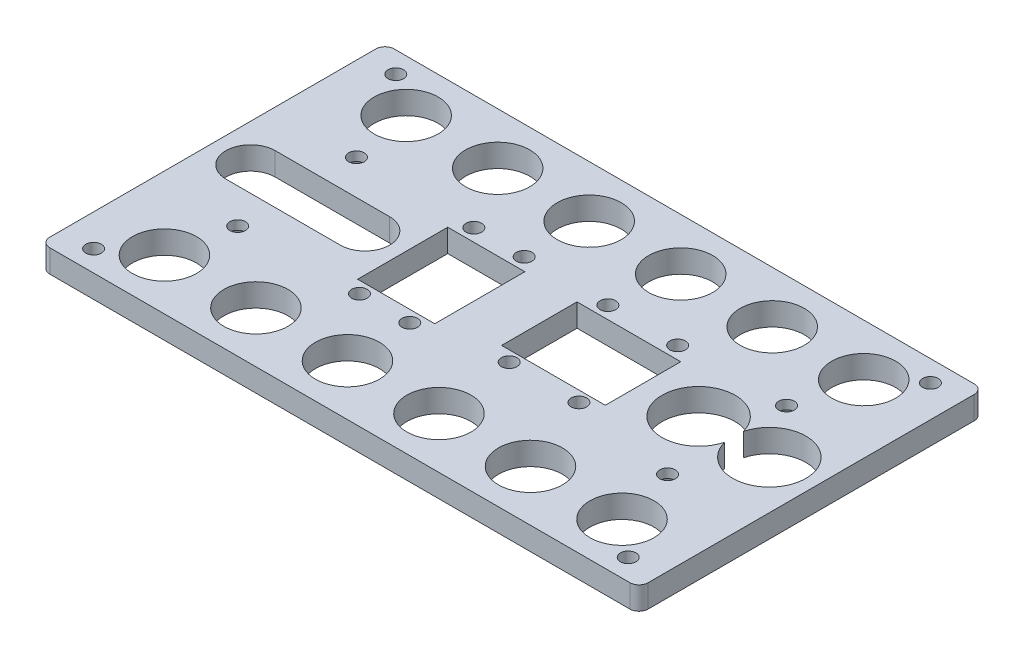
from build123d import *

# Parameters (mm, degrees)
SKETCH1_W           = 130.782832276
SKETCH1_H           = 75.259371088
SKETCH1_R           = 1.7
SKETCH1_R_2         = 7
SKETCH1_W_2         = 16.85151746
SKETCH1_H_2         = 19.689667769
SKETCH1_W_3         = 22.664698662
SKETCH1_H_3         = 16.485400984
BOSS_EXTRUDE3_DEPTH = 5
CUT_EXTRUDE1_DEPTH  = 3
FILLET1_R           = 2


with BuildPart() as part:
    # Sketch1 → Boss-Extrude3 (new body)
    with BuildSketch(Plane(origin=(0, 0, 0), x_dir=(1, 0, 0), z_dir=(0, 1, 0))):
        Rectangle(SKETCH1_W, SKETCH1_H)
        with Locations(Location((-58.42, 33.02, 0), (0, 0, 270))):
            Circle(SKETCH1_R, mode=Mode.SUBTRACT)
        with Locations(Location((-58.42, -33.02, 0), (0, 0, 270))):
            Circle(SKETCH1_R, mode=Mode.SUBTRACT)
        with Locations(Location((58.42, 33.02, 0), (0, 0, 270))):
            Circle(SKETCH1_R, mode=Mode.SUBTRACT)
        with Locations(Location((58.42, -33.02, 0), (0, 0, 270))):
            Circle(SKETCH1_R, mode=Mode.SUBTRACT)
        with Locations(Location((-20.838777713, 12.499959088, 0), (0, 0, 270))):
            Circle(SKETCH1_R, mode=Mode.SUBTRACT)
        with Locations(Location((-20.838777713, -12.500040912, 0), (0, 0, 270))):
            Circle(SKETCH1_R, mode=Mode.SUBTRACT)
        with Locations(Location((-9.838777713, 12.499959088, 0), (0, 0, 270))):
            Circle(SKETCH1_R, mode=Mode.SUBTRACT)
        with Locations(Location((-9.838777713, -12.500040912, 0), (0, 0, 270))):
            Circle(SKETCH1_R, mode=Mode.SUBTRACT)
        with Locations(Location((8.468303583, 12.485001846, 0), (0, 0, 270))):
            Circle(SKETCH1_R, mode=Mode.SUBTRACT)
        with Locations(Location((8.468303583, -9.090040912, 0), (0, 0, 270))):
            Circle(SKETCH1_R, mode=Mode.SUBTRACT)
        with Locations(Location((23.708296244, 12.499959088, 0), (0, 0, 270))):
            Circle(SKETCH1_R, mode=Mode.SUBTRACT)
        with Locations(Location((23.708296244, -9.090040912, 0), (0, 0, 270))):
            Circle(SKETCH1_R, mode=Mode.SUBTRACT)
        with Locations(Location((-47, 13, 0), (0, 0, 270))):
            Circle(SKETCH1_R, mode=Mode.SUBTRACT)
        with Locations(Location((-46.95213511, -13, 0), (0, 0, 270))):
            Circle(SKETCH1_R, mode=Mode.SUBTRACT)
        with Locations(Location((47, 13, 0), (0, 0, 270))):
            Circle(SKETCH1_R, mode=Mode.SUBTRACT)
        with Locations(Location((47, -13, 0), (0, 0, 270))):
            Circle(SKETCH1_R, mode=Mode.SUBTRACT)
        with Locations(Location((-49.48088922, 26.351150639, 0), (0, 0, 270))):
            Circle(SKETCH1_R_2, mode=Mode.SUBTRACT)
        with Locations(Location((-29.48088922, 26.351150639, 0), (0, 0, 270))):
            Circle(SKETCH1_R_2, mode=Mode.SUBTRACT)
        with Locations(Location((-9.48088922, 26.351150639, 0), (0, 0, 270))):
            Circle(SKETCH1_R_2, mode=Mode.SUBTRACT)
        with Locations(Location((10.51911078, 26.351150639, 0), (0, 0, 270))):
            Circle(SKETCH1_R_2, mode=Mode.SUBTRACT)
        with Locations(Location((30.51911078, 26.351150639, 0), (0, 0, 270))):
            Circle(SKETCH1_R_2, mode=Mode.SUBTRACT)
        with Locations(Location((50.51911078, 26.351150639, 0), (0, 0, 270))):
            Circle(SKETCH1_R_2, mode=Mode.SUBTRACT)
        with Locations(Location((-49.48088922, -26.480007122, 0), (0, 0, 270))):
            Circle(SKETCH1_R_2, mode=Mode.SUBTRACT)
        with Locations(Location((-29.48088922, -26.480007122, 0), (0, 0, 270))):
            Circle(SKETCH1_R_2, mode=Mode.SUBTRACT)
        with Locations(Location((-9.48088922, -26.480007122, 0), (0, 0, 270))):
            Circle(SKETCH1_R_2, mode=Mode.SUBTRACT)
        with Locations(Location((10.51911078, -26.480007122, 0), (0, 0, 270))):
            Circle(SKETCH1_R_2, mode=Mode.SUBTRACT)
        with Locations(Location((30.51911078, -26.480007122, 0), (0, 0, 270))):
            Circle(SKETCH1_R_2, mode=Mode.SUBTRACT)
        with Locations(Location((50.51911078, -26.480007122, 0), (0, 0, 270))):
            Circle(SKETCH1_R_2, mode=Mode.SUBTRACT)
        with Locations((-15.363894899, -0.098030908)):
            Rectangle(SKETCH1_W_2, SKETCH1_H_2, mode=Mode.SUBTRACT)
        with Locations((15.799758129, 1.504102484)):
            Rectangle(SKETCH1_W_3, SKETCH1_H_3, mode=Mode.SUBTRACT)
        with BuildLine():
            Line((-57.131435177, 5.386569447), (-32.131435177, 5.386569447))
            ThreePointArc((-32.131435177, 5.386569447), (-26.74486573, 0), (-32.131435177, -5.386569447))
            Line((-32.131435177, -5.386569447), (-57.131435177, -5.386569447))
            ThreePointArc((-57.131435177, -5.386569447), (-62.518004624, 0), (-57.131435177, 5.386569447))
        make_face(mode=Mode.SUBTRACT)
        with BuildLine():
            ThreePointArc((47.161472538, 3.408625582), (31.430083597, 1.352993065), (47.161472538, -0.702639453))
            ThreePointArc((47.161472538, -0.702639453), (62.892861479, 1.352993065), (47.161472538, 3.408625582))
        make_face(mode=Mode.SUBTRACT)
    extrude(amount=BOSS_EXTRUDE3_DEPTH)

    # Sketch2 → Cut-Extrude1 (cut)
    with BuildSketch(Plane.XZ):
        Polygon((-50.117691454, -13), (-48.558845727, -15.7), (-45.441154273, -15.7), (-43.882308546, -13), (-45.441154273, -10.3), (-48.558845727, -10.3), align=None)
        Polygon((-50.069826564, 13), (-48.510980837, 10.3), (-45.393289384, 10.3), (-43.834443657, 13), (-45.393289384, 15.7), (-48.510980837, 15.7), align=None)
        Polygon((43.882308546, -13), (45.441154273, -15.7), (48.558845727, -15.7), (50.117691454, -13), (48.558845727, -10.3), (45.441154273, -10.3), align=None)
        Polygon((43.882308546, 13), (45.441154273, 10.3), (48.558845727, 10.3), (50.117691454, 13), (48.558845727, 15.7), (45.441154273, 15.7), align=None)
    extrude(amount=-CUT_EXTRUDE1_DEPTH, mode=Mode.SUBTRACT)

    # Fillet1
    fillet1_edges = [part.edges().sort_by_distance(p)[0] for p in [
        (65.391416138, 2.5, 37.629685544),
        (-65.391416138, 2.5, 37.629685544),
        (-65.391416138, 2.5, -37.629685544),
        (65.391416138, 2.5, -37.629685544),
    ]]
    fillet(fillet1_edges, radius=FILLET1_R)


solid = part.part
